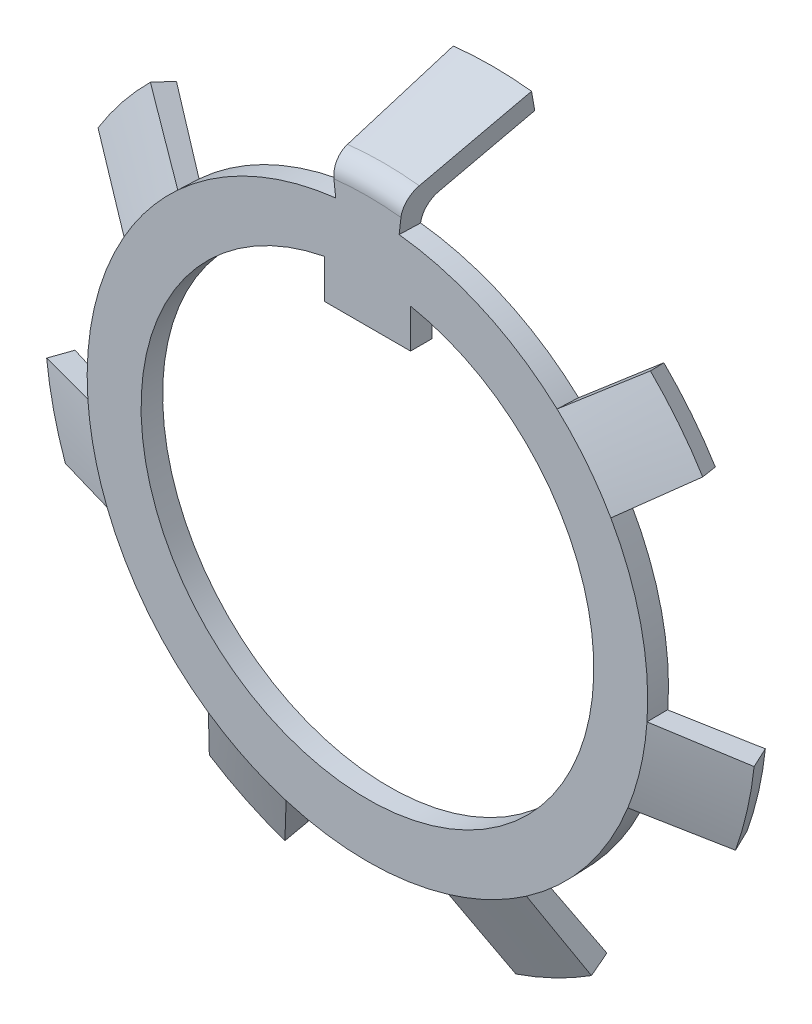
from build123d import *

# Parameters (mm, degrees)
CUT_EXTRUDE2_DEPTH           = 24.379246777
CUT_EXTRUDE2_DEPTH_BACK      = 24.379246777
CUT_EXTRUDE4_DEPTH           = 10
CUT_EXTRUDE4_DRAFT           = 2
CUT_EXTRUDE4_PROFILE_2_DEPTH = 10
CUT_EXTRUDE4_PROFILE_2_DRAFT = 2
CUT_EXTRUDE4_PROFILE_3_DEPTH = 10
CUT_EXTRUDE4_PROFILE_3_DRAFT = 2
CUT_EXTRUDE4_PROFILE_4_DEPTH = 10
CUT_EXTRUDE4_PROFILE_4_DRAFT = 2
CUT_EXTRUDE4_PROFILE_5_DEPTH = 10
CUT_EXTRUDE4_PROFILE_5_DRAFT = 2
CUT_EXTRUDE4_PROFILE_6_DEPTH = 10
CUT_EXTRUDE4_PROFILE_6_DRAFT = 2
CUT_EXTRUDE4_PROFILE_7_DEPTH = 10
CUT_EXTRUDE4_PROFILE_7_DRAFT = 2
CUT_EXTRUDE4_PROFILE_8_DEPTH = 10
CUT_EXTRUDE4_PROFILE_8_DRAFT = 2
CUT_EXTRUDE4_PROFILE_9_DEPTH = 10
CUT_EXTRUDE4_PROFILE_9_DRAFT = 2
REVOLVE3_ANGLE               = 13
FILLET1_R                    = 1


with BuildPart() as part:
    # Sketch1 → Revolve1 (revolve)
    with BuildSketch(Plane(origin=(0, 0, 0), x_dir=(0, 0, -1), z_dir=(1, 0, 0)), mode=Mode.PRIVATE) as revolve1_sk:
        Polygon((-1, 7.5), (-1, 13), (0.529028795, 16.5), (1.445399555, 16.099669349), (0, 13), (0, 7.5), align=None)
    revolve(revolve1_sk.sketch.rotate(Axis((0, 0, 1), (0, 0, -1)), 90), axis=Axis((0, 0, 1), (0, 0, -1)))

    # Sketch2 → Cut-Extrude2 (cut, two sides: drawn at the far end of the back side and taken through both)
    with BuildSketch(Plane.XY.offset(-CUT_EXTRUDE2_DEPTH_BACK)):
        with BuildLine():
            Line((-2, 8.5), (-2, 10.307764064))
            ThreePointArc((-2, 10.307764064), (0, -10.5), (2, 10.307764064))
            Line((2, 10.307764064), (2, 8.5))
            Line((2, 8.5), (-2, 8.5))
        make_face()
    extrude(amount=CUT_EXTRUDE2_DEPTH + CUT_EXTRUDE2_DEPTH_BACK, mode=Mode.SUBTRACT)


with BuildPart() as cut_extrude4_tool:
    # Sketch3 → Cut-Extrude4 (with draft: the straight prism first)
    with BuildSketch(Plane.XY.offset(1)):
        with BuildLine():
            ThreePointArc((11.558121734, 11.775390524), (7.159081695, 14.86598632), (2, 16.378339354))
            Line((2, 16.378339354), (2, 12.845232579))
            ThreePointArc((2, 12.845232579), (5.640488609, 11.712595283), (8.795827626, 9.57253448))
            Line((8.795827626, 9.57253448), (11.558121734, 11.775390524))
        make_face()
    extrude(amount=-CUT_EXTRUDE4_DEPTH)
    # Cut-Extrude4: the draft: its side faces are tilted about the plane it starts from
    cut_extrude4_sides = [cut_extrude4_tool.faces().sort_by_distance(p)[0] for p in [
        (10.17697468, 10.673962502, -4),
        (7.159081695, 14.86598632, -4),
        (2, 14.611785966, -4),
        (5.640488609, 11.712595283, -4),
    ]]
    draft(cut_extrude4_sides, Plane.XY.offset(1), CUT_EXTRUDE4_DRAFT)


with BuildPart() as part_1:
    add(part.part)

    # Cut-Extrude4: cut by cut_extrude4_tool
    add(cut_extrude4_tool.part, mode=Mode.SUBTRACT)


with BuildPart() as cut_extrude4_profile_2_tool:
    # Sketch3 → Cut-Extrude4 profile 2 (with draft: the straight prism first)
    with BuildSketch(Plane.XY.offset(1)):
        with BuildLine():
            ThreePointArc((2, 16.378339354), (1.001848456, 16.469556754), (0, 16.5))
            Line((0, 16.5), (0, 13))
            ThreePointArc((0, 13), (1.00298965, 12.961250393), (2, 12.845232579))
            Line((2, 12.845232579), (2, 16.378339354))
        make_face()
    extrude(amount=-CUT_EXTRUDE4_PROFILE_2_DEPTH)
    # Cut-Extrude4 profile 2: the draft: its side faces are tilted about the plane it starts from
    cut_extrude4_profile_2_sides = [cut_extrude4_profile_2_tool.faces().sort_by_distance(p)[0] for p in [
        (2, 14.611785966, -4),
        (1.001848456, 16.469556754, -4),
        (0, 14.75, -4),
        (1.00298965, 12.961250393, -4),
    ]]
    draft(cut_extrude4_profile_2_sides, Plane.XY.offset(1), CUT_EXTRUDE4_PROFILE_2_DRAFT)


with BuildPart() as part_2:
    add(part_1.part)

    # Cut-Extrude4 profile 2: cut by cut_extrude4_profile_2_tool
    add(cut_extrude4_profile_2_tool.part, mode=Mode.SUBTRACT)


with BuildPart() as cut_extrude4_profile_3_tool:
    # Sketch3 → Cut-Extrude4 profile 3 (with draft: the straight prism first)
    with BuildSketch(Plane.XY.offset(1)):
        with BuildLine():
            Line((0, 13), (0, 16.5))
            ThreePointArc((0, 16.5), (-1.001848456, 16.469556754), (-2, 16.378339354))
            Line((-2, 16.378339354), (-2, 12.845232579))
            ThreePointArc((-2, 12.845232579), (-1.00298965, 12.961250393), (0, 13))
        make_face()
    extrude(amount=-CUT_EXTRUDE4_PROFILE_3_DEPTH)
    # Cut-Extrude4 profile 3: the draft: its side faces are tilted about the plane it starts from
    cut_extrude4_profile_3_sides = [cut_extrude4_profile_3_tool.faces().sort_by_distance(p)[0] for p in [
        (-1.00298965, 12.961250393, -4),
        (0, 14.75, -4),
        (-1.001848456, 16.469556754, -4),
        (-2, 14.611785966, -4),
    ]]
    draft(cut_extrude4_profile_3_sides, Plane.XY.offset(1), CUT_EXTRUDE4_PROFILE_3_DRAFT)


with BuildPart() as part_3:
    add(part_2.part)

    # Cut-Extrude4 profile 3: cut by cut_extrude4_profile_3_tool
    add(cut_extrude4_profile_3_tool.part, mode=Mode.SUBTRACT)


with BuildPart() as cut_extrude4_profile_4_tool:
    # Sketch3 → Cut-Extrude4 profile 4 (with draft: the straight prism first)
    with BuildSketch(Plane.XY.offset(1)):
        with BuildLine():
            Line((-2, 12.845232579), (-2, 16.378339354))
            ThreePointArc((-2, 16.378339354), (-7.159081695, 14.86598632), (-11.558121734, 11.775390524))
            Line((-11.558121734, 11.775390524), (-8.795827626, 9.57253448))
            ThreePointArc((-8.795827626, 9.57253448), (-5.640488609, 11.712595283), (-2, 12.845232579))
        make_face()
    extrude(amount=-CUT_EXTRUDE4_PROFILE_4_DEPTH)
    # Cut-Extrude4 profile 4: the draft: its side faces are tilted about the plane it starts from
    cut_extrude4_profile_4_sides = [cut_extrude4_profile_4_tool.faces().sort_by_distance(p)[0] for p in [
        (-10.17697468, 10.673962502, -4),
        (-5.640488609, 11.712595283, -4),
        (-2, 14.611785966, -4),
        (-7.159081695, 14.86598632, -4),
    ]]
    draft(cut_extrude4_profile_4_sides, Plane.XY.offset(1), CUT_EXTRUDE4_PROFILE_4_DRAFT)


with BuildPart() as part_4:
    add(part_3.part)

    # Cut-Extrude4 profile 4: cut by cut_extrude4_profile_4_tool
    add(cut_extrude4_profile_4_tool.part, mode=Mode.SUBTRACT)


with BuildPart() as cut_extrude4_profile_5_tool:
    # Sketch3 → Cut-Extrude4 profile 5 (with draft: the straight prism first)
    with BuildSketch(Plane.XY.offset(1)):
        with BuildLine():
            ThreePointArc((8.908232855, -13.888606388), (12.900219461, -10.287581731), (15.522658324, -5.594379194))
            Line((15.522658324, -5.594379194), (12.078133911, -4.808188975))
            ThreePointArc((12.078133911, -4.808188975), (10.163809272, -8.105367424), (7.375275277, -10.705387176))
            Line((7.375275277, -10.705387176), (8.908232855, -13.888606388))
        make_face()
    extrude(amount=-CUT_EXTRUDE4_PROFILE_5_DEPTH)
    # Cut-Extrude4 profile 5: the draft: its side faces are tilted about the plane it starts from
    cut_extrude4_profile_5_sides = [cut_extrude4_profile_5_tool.faces().sort_by_distance(p)[0] for p in [
        (12.900219461, -10.287581731, -4),
        (13.800396118, -5.201284084, -4),
        (10.163809272, -8.105367424, -4),
        (8.141754066, -12.296996782, -4),
    ]]
    draft(cut_extrude4_profile_5_sides, Plane.XY.offset(1), CUT_EXTRUDE4_PROFILE_5_DRAFT)


with BuildPart() as part_5:
    add(part_4.part)

    # Cut-Extrude4 profile 5: cut by cut_extrude4_profile_5_tool
    add(cut_extrude4_profile_5_tool.part, mode=Mode.SUBTRACT)


with BuildPart() as cut_extrude4_profile_6_tool:
    # Sketch3 → Cut-Extrude4 profile 6 (with draft: the straight prism first)
    with BuildSketch(Plane.XY.offset(1)):
        with BuildLine():
            Line((-3.771399805, -12.440922133), (-5.304357384, -15.624141344))
            ThreePointArc((-5.304357384, -15.624141344), (0, -16.5), (5.304357384, -15.624141344))
            Line((5.304357384, -15.624141344), (3.771399805, -12.440922133))
            ThreePointArc((3.771399805, -12.440922133), (0, -13), (-3.771399805, -12.440922133))
        make_face()
    extrude(amount=-CUT_EXTRUDE4_PROFILE_6_DEPTH)
    # Cut-Extrude4 profile 6: the draft: its side faces are tilted about the plane it starts from
    cut_extrude4_profile_6_sides = [cut_extrude4_profile_6_tool.faces().sort_by_distance(p)[0] for p in [
        (0, -16.5, -4),
        (4.537878594, -14.032531738, -4),
        (0, -13, -4),
        (-4.537878594, -14.032531738, -4),
    ]]
    draft(cut_extrude4_profile_6_sides, Plane.XY.offset(1), CUT_EXTRUDE4_PROFILE_6_DRAFT)


with BuildPart() as part_6:
    add(part_5.part)

    # Cut-Extrude4 profile 6: cut by cut_extrude4_profile_6_tool
    add(cut_extrude4_profile_6_tool.part, mode=Mode.SUBTRACT)


with BuildPart() as cut_extrude4_profile_7_tool:
    # Sketch3 → Cut-Extrude4 profile 7 (with draft: the straight prism first)
    with BuildSketch(Plane.XY.offset(1)):
        with BuildLine():
            Line((-12.078133911, -4.808188975), (-15.522658324, -5.594379194))
            ThreePointArc((-15.522658324, -5.594379194), (-12.900219461, -10.287581731), (-8.908232855, -13.888606388))
            Line((-8.908232855, -13.888606388), (-7.375275277, -10.705387176))
            ThreePointArc((-7.375275277, -10.705387176), (-10.163809272, -8.105367424), (-12.078133911, -4.808188975))
        make_face()
    extrude(amount=-CUT_EXTRUDE4_PROFILE_7_DEPTH)
    # Cut-Extrude4 profile 7: the draft: its side faces are tilted about the plane it starts from
    cut_extrude4_profile_7_sides = [cut_extrude4_profile_7_tool.faces().sort_by_distance(p)[0] for p in [
        (-13.800396118, -5.201284084, -4),
        (-12.900219461, -10.287581731, -4),
        (-8.141754066, -12.296996782, -4),
        (-10.163809272, -8.105367424, -4),
    ]]
    draft(cut_extrude4_profile_7_sides, Plane.XY.offset(1), CUT_EXTRUDE4_PROFILE_7_DRAFT)


with BuildPart() as part_7:
    add(part_6.part)

    # Cut-Extrude4 profile 7: cut by cut_extrude4_profile_7_tool
    add(cut_extrude4_profile_7_tool.part, mode=Mode.SUBTRACT)


with BuildPart() as cut_extrude4_profile_8_tool:
    # Sketch3 → Cut-Extrude4 profile 8 (with draft: the straight prism first)
    with BuildSketch(Plane.XY.offset(1)):
        with BuildLine():
            ThreePointArc((16.5, 0), (15.876229646, 4.493921699), (14.052080941, 8.648064594))
            Line((14.052080941, 8.648064594), (11.289786833, 6.44520855))
            ThreePointArc((11.289786833, 6.44520855), (12.565174667, 3.33412441), (13, 0))
            ThreePointArc((13, 0), (12.992051982, -0.454516548), (12.968217647, -0.908477326))
            Line((12.968217647, -0.908477326), (16.412742059, -1.694667545))
            ThreePointArc((16.412742059, -1.694667545), (16.478171075, -0.848456251), (16.5, 0))
        make_face()
    extrude(amount=-CUT_EXTRUDE4_PROFILE_8_DEPTH)
    # Cut-Extrude4 profile 8: the draft: its side faces are tilted about the plane it starts from
    cut_extrude4_profile_8_sides = [cut_extrude4_profile_8_tool.faces().sort_by_distance(p)[0] for p in [
        (16.086310551, 3.67159541, -4),
        (12.674062858, 2.892772141, -4),
        (12.670933887, 7.546636572, -4),
        (14.690479853, -1.301572436, -4),
    ]]
    draft(cut_extrude4_profile_8_sides, Plane.XY.offset(1), CUT_EXTRUDE4_PROFILE_8_DRAFT)


with BuildPart() as part_8:
    add(part_7.part)

    # Cut-Extrude4 profile 8: cut by cut_extrude4_profile_8_tool
    add(cut_extrude4_profile_8_tool.part, mode=Mode.SUBTRACT)


with BuildPart() as cut_extrude4_profile_9_tool:
    # Sketch3 → Cut-Extrude4 profile 9 (with draft: the straight prism first)
    with BuildSketch(Plane.XY.offset(1)):
        with BuildLine():
            Line((-11.289786833, 6.44520855), (-14.052080941, 8.648064594))
            ThreePointArc((-14.052080941, 8.648064594), (-16.086310551, 3.67159541), (-16.412742059, -1.694667545))
            Line((-16.412742059, -1.694667545), (-12.968217647, -0.908477326))
            ThreePointArc((-12.968217647, -0.908477326), (-12.674062858, 2.892772141), (-11.289786833, 6.44520855))
        make_face()
    extrude(amount=-CUT_EXTRUDE4_PROFILE_9_DEPTH)
    # Cut-Extrude4 profile 9: the draft: its side faces are tilted about the plane it starts from
    cut_extrude4_profile_9_sides = [cut_extrude4_profile_9_tool.faces().sort_by_distance(p)[0] for p in [
        (-16.086310551, 3.67159541, -4),
        (-14.690479853, -1.301572436, -4),
        (-12.674062858, 2.892772141, -4),
        (-12.670933887, 7.546636572, -4),
    ]]
    draft(cut_extrude4_profile_9_sides, Plane.XY.offset(1), CUT_EXTRUDE4_PROFILE_9_DRAFT)


with BuildPart() as part_9:
    add(part_8.part)

    # Cut-Extrude4 profile 9: cut by cut_extrude4_profile_9_tool
    add(cut_extrude4_profile_9_tool.part, mode=Mode.SUBTRACT)

    # Sketch4 → Revolve3 (revolve, symmetric)
    with BuildSketch(Plane(origin=(0, 0, 0), x_dir=(0, 0, -1), z_dir=(1, 0, 0))) as revolve3_sk:
        Polygon((-1, 10), (-1, 14.5), (4.795554958, 16.052914271), (5.054374003, 15.086988444), (0, 13.732673012), (0, 10), align=None)
    revolve(axis=Axis((0, 0, 1), (0, 0, -1)), revolution_arc=REVOLVE3_ANGLE / 2)
    revolve(revolve3_sk.sketch, axis=Axis((0, 0, 1), (0, 0, 1)), revolution_arc=REVOLVE3_ANGLE / 2)

    # Fillet1
    fillet1_edges = [part_9.edges().sort_by_distance(p)[0] for p in [
        (0, 14.5, 1),
        (0, 13.732673012, 0),
    ]]
    fillet(fillet1_edges, radius=FILLET1_R)


solid = part_9.part
